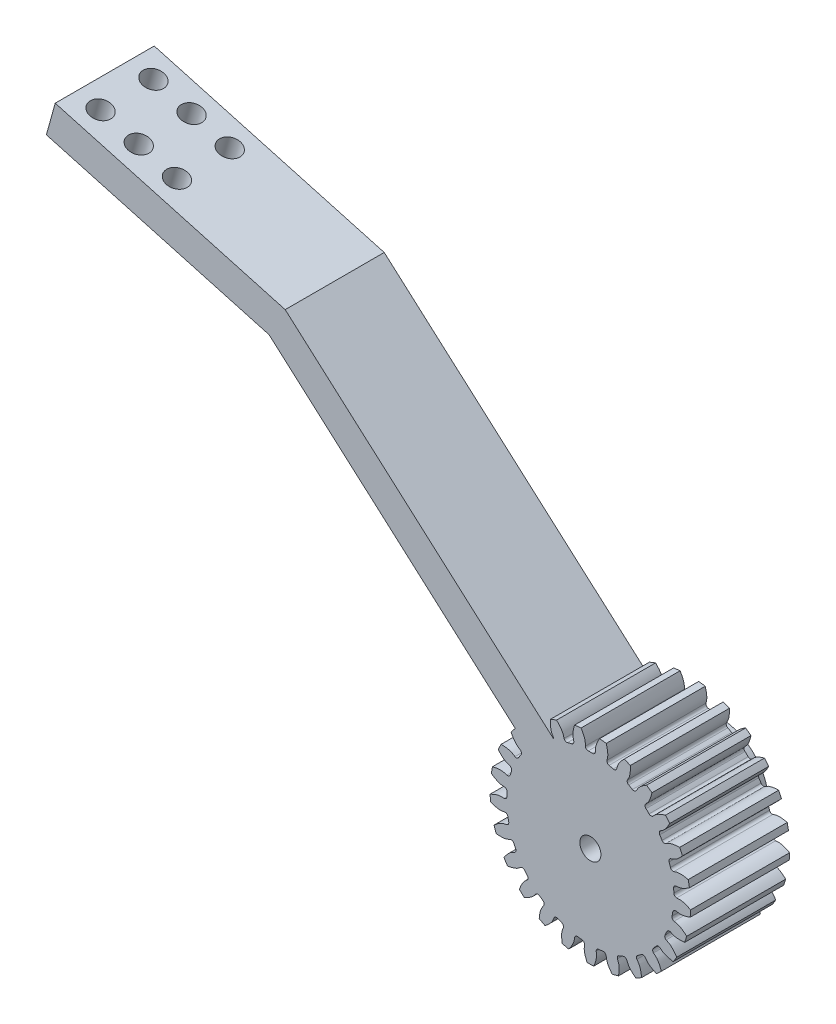
from build123d import *

# Parameters (mm, degrees)
SKETCH_1_R          = 15.1875
LASHENA_DEPTH       = 15
CUT_EXTRUDEA_DEPTH  = 15
WWW_KYTOOL_CN_COUNT = 25
SKETCH_2_R          = 1.6
CUT_EXTRUDE_1_DEPTH = 19
SKETCH_3_R          = 7.5
SKETCH_3_R_2        = 1.6
EXTRUDE_1_DEPTH     = 4.5
EXTRUDE_3_DEPTH     = 15
SKETCH_7_R          = 1.6
CUT_EXTRUDE_2_DEPTH = 30
SKETCH_8_R          = 1.6
CUT_EXTRUDE_3_DEPTH = 10


with BuildPart() as part:
    # 草图1 → LaShenA (new body)
    with BuildSketch(Plane.XY):
        Circle(SKETCH_1_R)
    extrude(amount=LASHENA_DEPTH)

    # SketchA → Cut-ExtrudeA (cut)
    with BuildSketch(Plane.XY.offset(15)):
        with BuildLine():
            ThreePointArc((0.324443957, 12.652090743), (0, 12.65625), (-0.324443957, 12.652090743))
            ThreePointArc((-0.324443957, 12.652090743), (-0.622114469, 12.762349707), (-0.76170327, 13.047445726))
            add(Edge.make_bspline(
                [(-0.76170327, 13.047445726), (-0.775328228, 13.228930177), (-0.759394526, 13.44165743), (-0.788755156, 13.664934603), (-0.799675486, 13.722720233), (-0.809304298, 13.768536103), (-0.821659042, 13.821123901), (-0.837010482, 13.880389795), (-0.855686072, 13.946216468), (-0.877989942, 14.018479865), (-0.904228386, 14.097043919), (-0.93470134, 14.181762379), (-0.969704609, 14.272478415), (-1.009528763, 14.369024922), (-1.054459055, 14.471224618), (-1.104775036, 14.578890226), (-1.160750274, 14.691824636), (-1.222652034, 14.809821084), (-1.290740991, 14.932663338), (-1.365270926, 15.060125898), (-1.446488467, 15.191974195), (-1.534632695, 15.327964812), (-1.66440648, 15.518440882), (-1.768856304, 15.660717762), (-1.842005537, 15.755887549)],
                knots=[0.123705737, 0.123705737, 0.123705737, 0.123705737, 0.284026838, 0.310496331, 0.322146932, 0.335915822, 0.351803004, 0.369808477, 0.38993224, 0.412174294, 0.436534639, 0.463013274, 0.491610201, 0.522325418, 0.555158926, 0.590110724, 0.627180814, 0.666369194, 0.707675866, 0.751100828, 0.796644081, 0.844305624, 0.894085459, 1, 1, 1, 1], degree=3))
            ThreePointArc((-1.842005537, 15.755887549), (0, 15.86319567), (1.842005537, 15.755887549))
            add(Edge.make_bspline(
                [(0.76170327, 13.047445726), (0.775328228, 13.228930177), (0.759394526, 13.44165743), (0.788755156, 13.664934603), (0.799675486, 13.722720233), (0.809304298, 13.768536103), (0.821659042, 13.821123901), (0.837010482, 13.880389795), (0.855686072, 13.946216468), (0.877989942, 14.018479865), (0.904228386, 14.097043919), (0.93470134, 14.181762379), (0.969704609, 14.272478415), (1.009528763, 14.369024922), (1.054459055, 14.471224618), (1.104775036, 14.578890226), (1.160750274, 14.691824636), (1.222652034, 14.809821084), (1.290740991, 14.932663338), (1.365270926, 15.060125898), (1.446488467, 15.191974195), (1.534632695, 15.327964812), (1.66440648, 15.518440882), (1.768856304, 15.660717762), (1.842005537, 15.755887549)],
                knots=[0.123705737, 0.123705737, 0.123705737, 0.123705737, 0.284026838, 0.310496331, 0.322146932, 0.335915822, 0.351803004, 0.369808477, 0.38993224, 0.412174294, 0.436534639, 0.463013274, 0.491610201, 0.522325418, 0.555158926, 0.590110724, 0.627180814, 0.666369194, 0.707675866, 0.751100828, 0.796644081, 0.844305624, 0.894085459, 1, 1, 1, 1], degree=3))
            ThreePointArc((0.76170327, 13.047445726), (0.622114469, 12.762349707), (0.324443957, 12.652090743))
        make_face()
    cut_extrudea = extrude(amount=-CUT_EXTRUDEA_DEPTH, mode=Mode.SUBTRACT)

    # www.KYTool.cn: Cut-ExtrudeA ×25 about axis
    www_kytool_cn_axis = Axis((0, 0, -88.99), (0, 0, 1))
    for i in range(1, WWW_KYTOOL_CN_COUNT):
        add(cut_extrudea.rotate(www_kytool_cn_axis, i * 360 / WWW_KYTOOL_CN_COUNT), mode=Mode.SUBTRACT)

    # 草图2 → 切除-拉伸1 (cut)
    with BuildSketch(Plane.XY.offset(15)):
        Circle(SKETCH_2_R)
    extrude(amount=-CUT_EXTRUDE_1_DEPTH, mode=Mode.SUBTRACT)

    # 草图3 → 凸台-拉伸1 (add)
    with BuildSketch(Plane(origin=(0, 0, 0), x_dir=(-1, 0, 0), z_dir=(0, 0, -1))):
        with Locations(Location((0, 0, 0), (0, 0, 180))):
            Circle(SKETCH_3_R)
        with Locations(Location((0, 0, 0), (0, 0, 180))):
            Circle(SKETCH_3_R_2, mode=Mode.SUBTRACT)
    extrude(amount=EXTRUDE_1_DEPTH)

    # 草图6 → 凸台-拉伸3 (add)
    with BuildSketch(Plane.XY.offset(15)):
        with BuildLine():
            Line((-1.12328717, 0.994095535), (-48.675777385, 43.077473185))
            Line((-48.675777385, 43.077473185), (-82.401465203, 52.435783995))
            Line((-82.401465203, 52.435783995), (-81.064563658, 57.253739397))
            Line((-81.064563658, 57.253739397), (-46.226563192, 47.586780546))
            Line((-46.226563192, 47.586780546), (3.313651783, 3.744290568))
            Line((3.313651783, 3.744290568), (0.994095535, 1.12328717))
            ThreePointArc((0.994095535, 1.12328717), (-0.091352281, 1.497215669), (-1.12328717, 0.994095535))
        make_face()
    extrude(amount=-EXTRUDE_3_DEPTH)

    # 草图7 → 切除-拉伸2 (cut)
    with BuildSketch(Plane.XY.offset(15)):
        Circle(SKETCH_7_R)
    extrude(amount=-CUT_EXTRUDE_2_DEPTH, mode=Mode.SUBTRACT)

    # 草图8 → 切除-拉伸3 (cut)
    with BuildSketch(Plane(origin=(8.955669364, 32.274639658, 0), x_dir=(0.9635910805108918, -0.2673803088483744, 0), z_dir=(0.2673803088483744, 0.9635910805108919, 0))):
        with Locations(Location((-89.921613009, -3.5, 0), (0, 0, 180))):
            Circle(SKETCH_8_R)
        with Locations((-89.921613009, -11.5)):
            Circle(SKETCH_8_R)
        with Locations(Location((-83.921613009, -3.5, 0), (0, 0, 180))):
            Circle(SKETCH_8_R)
        with Locations((-83.921613009, -11.5)):
            Circle(SKETCH_8_R)
        with Locations(Location((-77.921613009, -3.5, 0), (0, 0, 180))):
            Circle(SKETCH_8_R)
        with Locations((-77.921613009, -11.5)):
            Circle(SKETCH_8_R)
    extrude(amount=-CUT_EXTRUDE_3_DEPTH, mode=Mode.SUBTRACT)


solid = part.part
